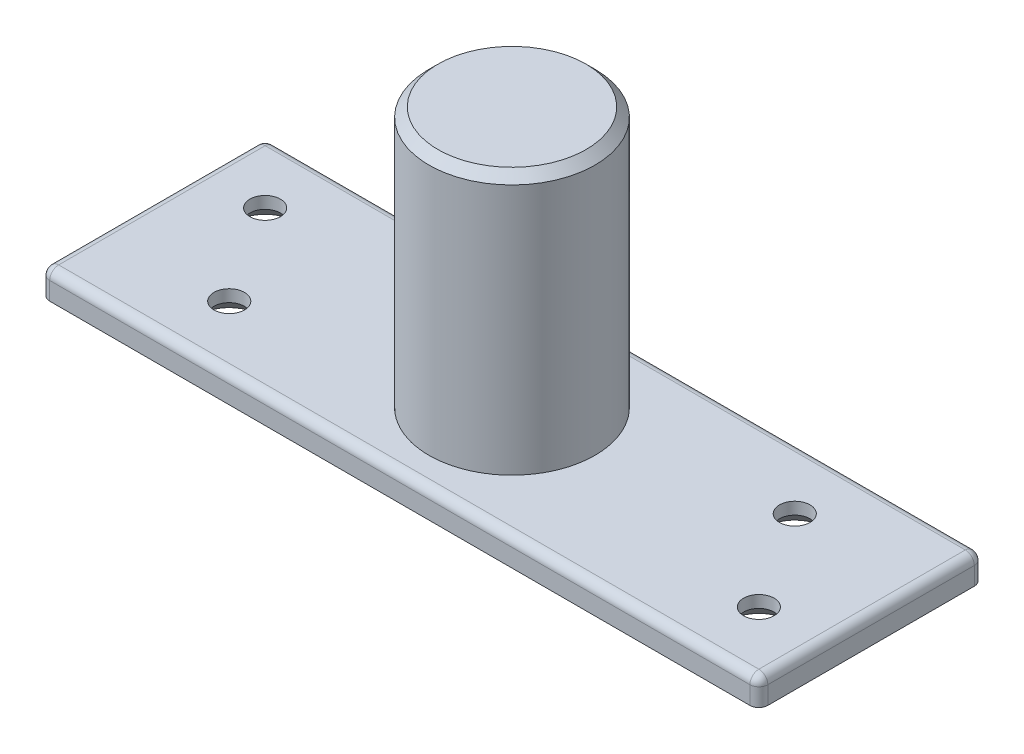
from build123d import *

# Parameters (mm, degrees)
ESBO_O1_R                           = 9.25
RESSALTO_EXTRUS_O1_DEPTH            = 1.5
ESBO_O3_R                           = 9.25
RESSALTO_EXTRUS_O3_DEPTH            = 32
CASCA1_T                            = -3
CHANFRO1_SIZE                       = 1
FILETE1_R                           = 1
CHANFRO2_SIZE                       = 1
ESCAREADO_PARA_SFHCS_M31_AT_2_COUNT = 2
ESCAREADO_PARA_SFHCS_M31_AT_2_PITCH = 13.03840481
ESCAREADO_PARA_SFHCS_M31_AT_3_COUNT = 2
ESCAREADO_PARA_SFHCS_M31_AT_3_PITCH = 53.150729064
ESCAREADO_PARA_SFHCS_M31_AT_4_COUNT = 2
ESCAREADO_PARA_SFHCS_M31_AT_4_PITCH = 59


with BuildPart() as part:
    # Esboço1 → Ressalto-extrusão1 (new, symmetric)
    with BuildSketch(Plane(origin=(0, 0, 0), x_dir=(1, 0, 0), z_dir=(0, 1, 0))):
        with BuildLine():
            Line((-39, -12.5), (39, -12.5))
            ThreePointArc((39, -12.5), (39.707106781, -12.207106781), (40, -11.5))
            Line((40, -11.5), (40, 11.5))
            ThreePointArc((40, 11.5), (39.707106781, 12.207106781), (39, 12.5))
            Line((39, 12.5), (-39, 12.5))
            ThreePointArc((-39, 12.5), (-39.707106781, 12.207106781), (-40, 11.5))
            Line((-40, 11.5), (-40, -11.5))
            ThreePointArc((-40, -11.5), (-39.707106781, -12.207106781), (-39, -12.5))
        make_face()
        with Locations(Location((0, 0, 0), (0, 0, 270))):
            Circle(ESBO_O1_R, mode=Mode.SUBTRACT)
    extrude(amount=RESSALTO_EXTRUS_O1_DEPTH, both=True)

    # Filete1
    filete1_edges = [part.edges().sort_by_distance(p)[0] for p in [
        (39.707106781, 1.5, -12.207106781),
        (0, 1.5, -12.5),
        (-39.707106781, 1.5, -12.207106781),
        (-40, 1.5, 0),
        (-39.707106781, 1.5, 12.207106781),
        (0, 1.5, 12.5),
        (39.707106781, 1.5, 12.207106781),
        (40, 1.5, 0),
    ]]
    fillet(filete1_edges, radius=FILETE1_R)

    # Esboço6 → Escareado para SFHCS M31 (revolve, cut)
    with BuildSketch(Plane(origin=(26, -1.5, -5.5), x_dir=(0, 0, -1), z_dir=(1, 0, 0))):
        Polygon((0, 0), (0, 32), (1.7, 32), (1.7, 1.66), (3.36, 0), align=None)
    escareado_para_sfhcs_m31 = revolve(axis=Axis((26, -7.85, -5.5), (0, 1, 0)), mode=Mode.SUBTRACT)

    # Escareado para SFHCS M31 at 2: Escareado para SFHCS M31 ×2
    with Locations(*[Vector(0.536875492193159, 0, 0.8436614877321077) * (i * ESCAREADO_PARA_SFHCS_M31_AT_2_PITCH) for i in range(1, ESCAREADO_PARA_SFHCS_M31_AT_2_COUNT)]):
        add(escareado_para_sfhcs_m31, mode=Mode.SUBTRACT)

    # Escareado para SFHCS M31 at 3: Escareado para SFHCS M31 ×2
    with Locations(*[Vector(-0.9783497031189412, 0, 0.20695859104439146) * (i * ESCAREADO_PARA_SFHCS_M31_AT_3_PITCH) for i in range(1, ESCAREADO_PARA_SFHCS_M31_AT_3_COUNT)]):
        add(escareado_para_sfhcs_m31, mode=Mode.SUBTRACT)

    # Escareado para SFHCS M31 at 4: Escareado para SFHCS M31 ×2
    with Locations(*[(-i * ESCAREADO_PARA_SFHCS_M31_AT_4_PITCH, 0, 0) for i in range(1, ESCAREADO_PARA_SFHCS_M31_AT_4_COUNT)]):
        add(escareado_para_sfhcs_m31, mode=Mode.SUBTRACT)


with BuildPart() as body_2:
    # Esboço3 → Ressalto-extrusão3 (new body)
    with BuildSketch(Plane.XZ.offset(1.5)):
        with Locations(Location((0, 0, 0), (0, 0, 270))):
            Circle(ESBO_O3_R)
    extrude(amount=-RESSALTO_EXTRUS_O3_DEPTH)

    # Casca1
    casca1_openings = [body_2.faces().sort_by_distance(p)[0] for p in [
        (0, -1.5, 0),
    ]]
    offset(amount=CASCA1_T, openings=casca1_openings, kind=Kind.INTERSECTION)

    # Chanfro1
    chanfro1_edges = [body_2.edges().sort_by_distance(p)[0] for p in [
        (0, 30.5, 9.25),
    ]]
    chamfer(chanfro1_edges, length=CHANFRO1_SIZE)

    # Chanfro2
    chanfro2_edges = [body_2.edges().sort_by_distance(p)[0] for p in [
        (0, -1.5, 9.25),
        (0, -1.5, 6.25),
    ]]
    chamfer(chanfro2_edges, length=CHANFRO2_SIZE)


solid = Compound([part.part, body_2.part])
